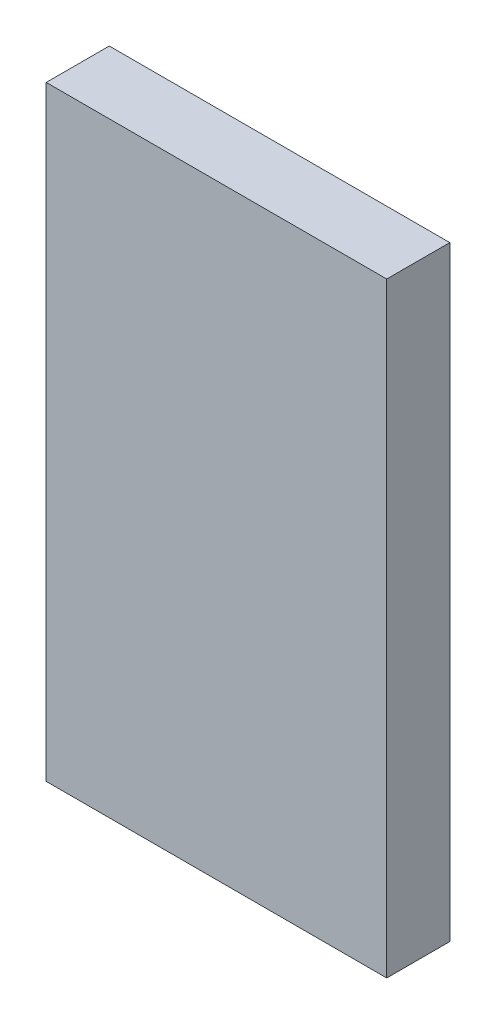
from build123d import *

# Parameters (mm, degrees)
SKETCH1_W           = 54
SKETCH1_H           = 96
BOSS_EXTRUDE1_DEPTH = 10


with BuildPart() as part:
    # Sketch1 → Boss-Extrude1 (new body)
    with BuildSketch(Plane.XY):
        Rectangle(SKETCH1_W, SKETCH1_H)
    extrude(amount=BOSS_EXTRUDE1_DEPTH)


solid = part.part
